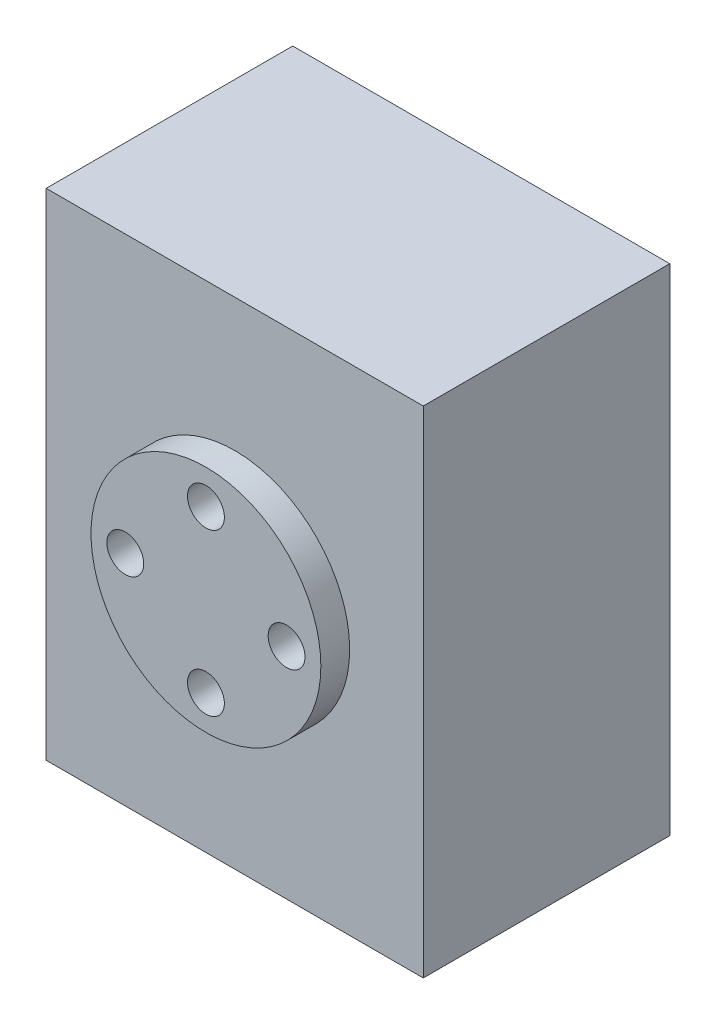
from build123d import *

# Parameters (mm, degrees)
SKETCH1_R           = 9.975
BOSS_EXTRUDE1_DEPTH = 2.5
SKETCH3_W           = 24.73
SKETCH3_H           = 35
BOSS_EXTRUDE4_DEPTH = 2.5
SKETCH3_5_W         = 32.73
SKETCH3_5_H         = 43
SKETCH3_5_W_2       = 24.73
SKETCH3_5_H_2       = 35
BOSS_EXTRUDE5_DEPTH = 21.4
SKETCH4_W           = 5.2
SKETCH4_H           = 1.1
SKETCH4_W_2         = 3.2
SKETCH4_H_2         = 1.5
BOSS_EXTRUDE6_DEPTH = 18.9
SKETCH6_W           = 18.33
SKETCH6_H           = 1.5
BOSS_EXTRUDE7_DEPTH = 5.3
SKETCH2_R           = 1.6
CUT_EXTRUDE1_DEPTH  = 37


with BuildPart() as part:
    # Sketch1 → Boss-Extrude1 (new body)
    with BuildSketch(Plane.XY):
        Circle(SKETCH1_R)
    extrude(amount=BOSS_EXTRUDE1_DEPTH)

    # Sketch3 → Boss-Extrude4 (add)
    with BuildSketch(Plane(origin=(0, 0, 0), x_dir=(-1, 0, 0), z_dir=(0, 0, -1))):
        Rectangle(SKETCH3_W, SKETCH3_H)
    extrude(amount=BOSS_EXTRUDE4_DEPTH)

    # Sketch3<5> → Boss-Extrude5 (add)
    with BuildSketch(Plane(origin=(0, 0, 0), x_dir=(-1, 0, 0), z_dir=(0, 0, -1))):
        Rectangle(SKETCH3_5_W, SKETCH3_5_H)
        Rectangle(SKETCH3_5_W_2, SKETCH3_5_H_2, mode=Mode.SUBTRACT)
    extrude(amount=BOSS_EXTRUDE5_DEPTH)

    # Sketch4 → Boss-Extrude6 (add)
    with BuildSketch(Plane(origin=(0, 0, -2.5), x_dir=(-1, 0, 0), z_dir=(0, 0, -1))):
        with Locations((9.765, 16.95)):
            Rectangle(SKETCH4_W, SKETCH4_H)
        with Locations((-9.765, 16.95)):
            Rectangle(SKETCH4_W, SKETCH4_H)
        with Locations((10.765, -16.75)):
            Rectangle(SKETCH4_W_2, SKETCH4_H_2)
        with Locations((-10.765, -16.75)):
            Rectangle(SKETCH4_W_2, SKETCH4_H_2)
    extrude(amount=BOSS_EXTRUDE6_DEPTH)

    # Sketch6 → Boss-Extrude7 (add)
    with BuildSketch(Plane(origin=(0, 0, -2.5), x_dir=(-1, 0, 0), z_dir=(0, 0, -1))):
        with Locations((0, -16.75)):
            Rectangle(SKETCH6_W, SKETCH6_H)
    extrude(amount=BOSS_EXTRUDE7_DEPTH)

    # Sketch2 → Cut-Extrude1 (cut)
    with BuildSketch(Plane.XY.offset(2.5)):
        with Locations((7, 0)):
            Circle(SKETCH2_R)
        with Locations((0, -7)):
            Circle(SKETCH2_R)
        with Locations((-7, 0)):
            Circle(SKETCH2_R)
        with Locations((0, 7)):
            Circle(SKETCH2_R)
    extrude(amount=-CUT_EXTRUDE1_DEPTH, mode=Mode.SUBTRACT)


solid = part.part
